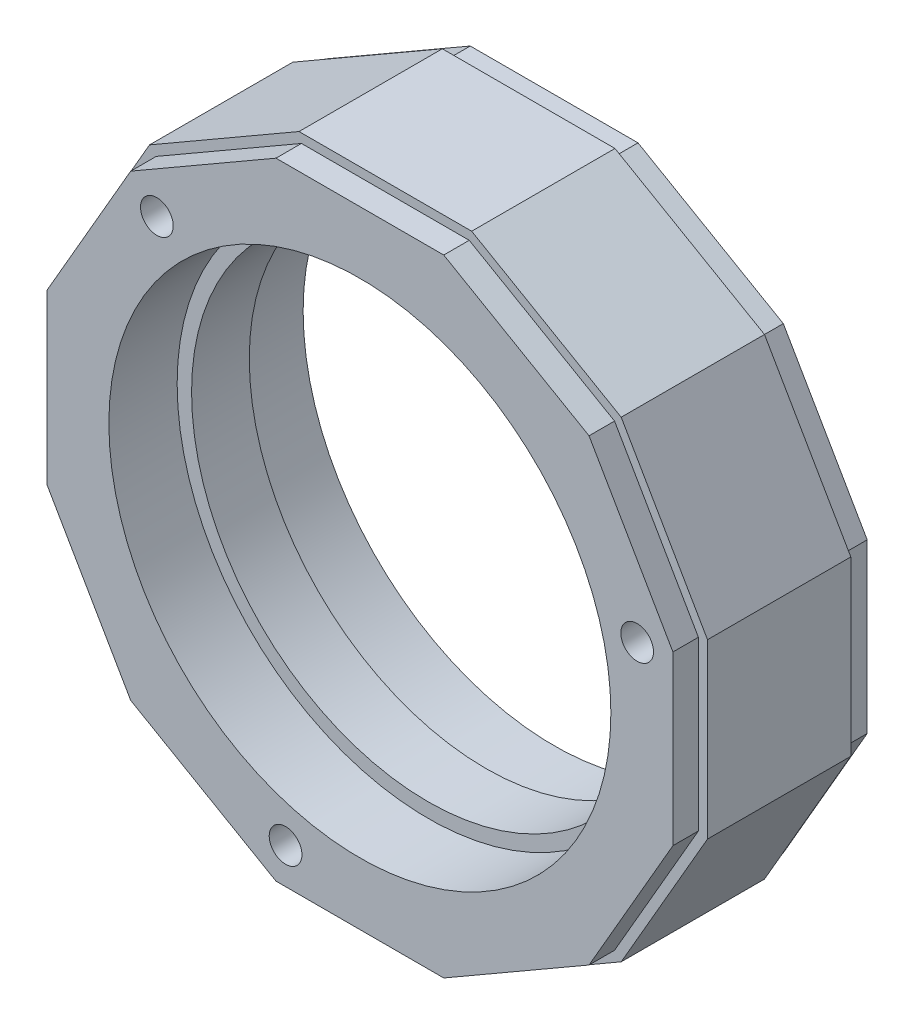
from build123d import *

# Parameters (mm, degrees)
S01_SMALLER_TWELVE_FLAT_END_BEAD_SEATS_R      = 24.6
F_01_SMALLER_TWELVE_FLAT_END_BEAD_SEATS_DEPTH = 20.2
F_02_START                                    = 2.65
S02_RAISED_CENTRAL_TYRE_DRIVE_KEY_R           = 24.6
F_02_RAISED_CENTRAL_TYRE_DRIVE_KEY_DEPTH      = 14.9
F_03_START                                    = -0.1
S03_INBOARD_6808_OUTER_RACE_SEAT_R            = 26.1
F_03_INBOARD_6808_OUTER_RACE_SEAT_DEPTH       = 7.2
F_04_START                                    = 13.1
S04_OUTBOARD_6808_OUTER_RACE_SEAT_R           = 26.1
F_04_OUTBOARD_6808_OUTER_RACE_SEAT_DEPTH      = 7.2
F_05_START                                    = -0.1
S05_THREE_TYRE_FLANGE_THROUGH_HOLES_R         = 1.7
F_05_THREE_TYRE_FLANGE_THROUGH_HOLES_DEPTH    = 20.4


with BuildPart() as part:
    # S01 - Smaller twelve-flat end bead seats → 01 - Smaller twelve-flat end bead seats (new body)
    with BuildSketch(Plane.XY):
        Polygon((32.551700346, 8.72220182), (23.829498526, 23.829498526), (8.72220182, 32.551700346), (-8.72220182, 32.551700346), (-23.829498526, 23.829498526), (-32.551700346, 8.72220182), (-32.551700346, -8.72220182), (-23.829498526, -23.829498526), (-8.72220182, -32.551700346), (8.72220182, -32.551700346), (23.829498526, -23.829498526), (32.551700346, -8.72220182), align=None)
        Circle(S01_SMALLER_TWELVE_FLAT_END_BEAD_SEATS_R, mode=Mode.SUBTRACT)
    extrude(amount=F_01_SMALLER_TWELVE_FLAT_END_BEAD_SEATS_DEPTH)

    # S02 - Raised central tyre drive key → 02 - Raised central tyre drive key (add)
    with BuildSketch(Plane.XY.offset(F_02_START)):
        Polygon((33.498307656, 8.975844484), (24.522463172, 24.522463172), (8.975844484, 33.498307656), (-8.975844484, 33.498307656), (-24.522463172, 24.522463172), (-33.498307656, 8.975844484), (-33.498307656, -8.975844484), (-24.522463172, -24.522463172), (-8.975844484, -33.498307656), (8.975844484, -33.498307656), (24.522463172, -24.522463172), (33.498307656, -8.975844484), align=None)
        Circle(S02_RAISED_CENTRAL_TYRE_DRIVE_KEY_R, mode=Mode.SUBTRACT)
    extrude(amount=F_02_RAISED_CENTRAL_TYRE_DRIVE_KEY_DEPTH)

    # S03 - Inboard 6808 outer race seat → 03 - Inboard 6808 outer race seat (cut)
    with BuildSketch(Plane.XY.offset(F_03_START)):
        Circle(S03_INBOARD_6808_OUTER_RACE_SEAT_R)
    extrude(amount=F_03_INBOARD_6808_OUTER_RACE_SEAT_DEPTH, mode=Mode.SUBTRACT)

    # S04 - Outboard 6808 outer race seat → 04 - Outboard 6808 outer race seat (cut)
    with BuildSketch(Plane.XY.offset(F_04_START)):
        Circle(S04_OUTBOARD_6808_OUTER_RACE_SEAT_R)
    extrude(amount=F_04_OUTBOARD_6808_OUTER_RACE_SEAT_DEPTH, mode=Mode.SUBTRACT)

    # S05 - Three tyre-flange through holes → 05 - Three tyre-flange through holes (cut)
    with BuildSketch(Plane.XY.offset(F_05_START)):
        with Locations((28.832885915, 7.725748496)):
            Circle(S05_THREE_TYRE_FLANGE_THROUGH_HOLES_R)
        with Locations((-21.107137418, 21.107137418)):
            Circle(S05_THREE_TYRE_FLANGE_THROUGH_HOLES_R)
        with Locations((-7.725748496, -28.832885915)):
            Circle(S05_THREE_TYRE_FLANGE_THROUGH_HOLES_R)
    extrude(amount=F_05_THREE_TYRE_FLANGE_THROUGH_HOLES_DEPTH, mode=Mode.SUBTRACT)


solid = part.part
